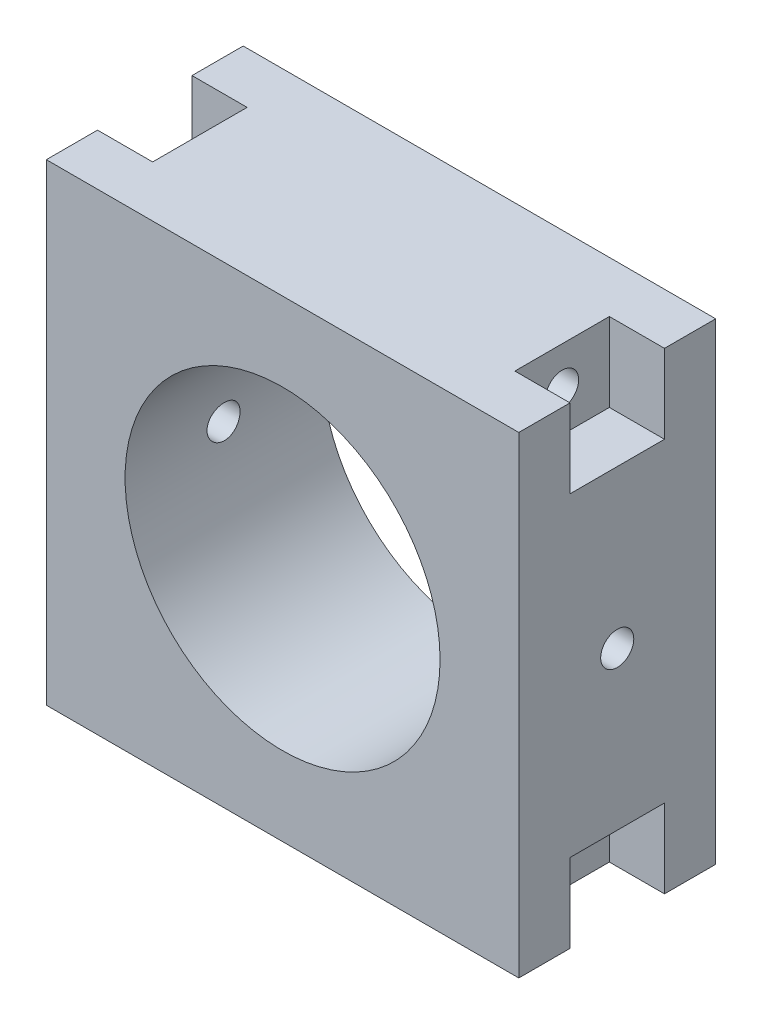
from build123d import *

# Parameters (mm, degrees)
BOSS_EXTRUDE1_DEPTH = 25
SKETCH2_R           = 2.1
CUT_EXTRUDE1_DEPTH  = 72.589105316
CUT_EXTRUDE2_DEPTH  = 10


with BuildPart() as part:
    # Sketch1 → Boss-Extrude1 (new body)
    with BuildSketch(Plane.XY):
        with BuildLine():
            Line((-30, 0), (-20, 0))
            ThreePointArc((-20, 0), (0, 20), (20, 0))
            Line((20, 0), (30, 0))
            Line((30, 0), (30, 30))
            Line((30, 30), (-30, 30))
            Line((-30, 30), (-30, 0))
        make_face()
        with BuildLine():
            ThreePointArc((20, 0), (0, -20), (-20, 0))
            Line((-20, 0), (-30, 0))
            Line((-30, 0), (-30, -30))
            Line((-30, -30), (30, -30))
            Line((30, -30), (30, 0))
            Line((30, 0), (20, 0))
        make_face()
    extrude(amount=BOSS_EXTRUDE1_DEPTH)

    # Sketch2 → Cut-Extrude1 (cut, through all)
    with BuildSketch(Plane(origin=(30, 0, 0), x_dir=(0, 0, -1), z_dir=(1, 0, 0))):
        with Locations((-12.5, 25)):
            Circle(SKETCH2_R)
        with Locations((-12.5, -25)):
            Circle(SKETCH2_R)
        with Locations((-12.5, 0)):
            Circle(SKETCH2_R)
    extrude(amount=-CUT_EXTRUDE1_DEPTH, mode=Mode.SUBTRACT)

    # Sketch3 → Cut-Extrude2 (cut)
    with BuildSketch(Plane(origin=(0, 30, 0), x_dir=(1, 0, 0), z_dir=(0, 1, 0))):
        Polygon((-30, -18.5), (-23, -18.5), (-23, -15), (-23, -10), (-23, -6.5), (-30, -6.5), align=None)
        Polygon((23, -10), (23, -15), (23, -18.5), (30, -18.5), (30, -6.5), (23, -6.5), align=None)
    cut_extrude2 = extrude(amount=-CUT_EXTRUDE2_DEPTH, mode=Mode.SUBTRACT)

    # Mirror1: Cut-Extrude2 across plane
    add(cut_extrude2.mirror(Plane.ZX), mode=Mode.SUBTRACT)


solid = part.part
